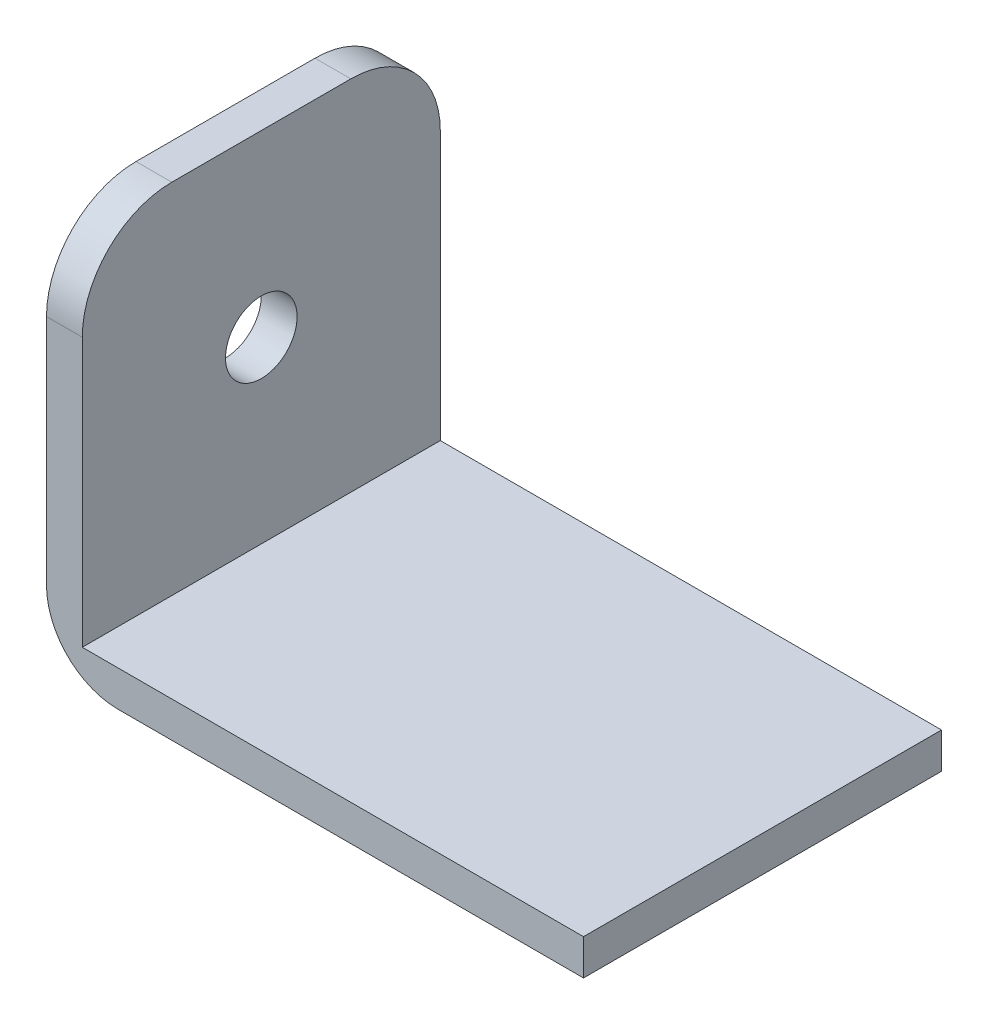
from build123d import *

# Parameters (mm, degrees)
SKETCH1_W           = 5
SKETCH1_H           = 50
SKETCH1_W_2         = 70
SKETCH1_H_2         = 5
BOSS_EXTRUDE1_DEPTH = 50
SKETCH2_R           = 5
CUT_EXTRUDE1_DEPTH  = 5
FILLET1_R           = 10
FILLET2_R           = 12.5


with BuildPart() as part:
    # Sketch1 → Boss-Extrude1 (new body)
    with BuildSketch(Plane.XY):
        with Locations((2.5, -25)):
            Rectangle(SKETCH1_W, SKETCH1_H)
        with Locations((40, -52.5)):
            Rectangle(SKETCH1_W_2, SKETCH1_H_2)
        with Locations((2.5, -52.5)):
            Rectangle(SKETCH1_W, SKETCH1_H_2)
    extrude(amount=BOSS_EXTRUDE1_DEPTH)

    # Sketch2 → Cut-Extrude1 (cut)
    with BuildSketch(Plane.ZY):
        with Locations(Location((25, -25, 0), (0, 0, 270))):
            Circle(SKETCH2_R)
    extrude(amount=-CUT_EXTRUDE1_DEPTH, mode=Mode.SUBTRACT)

    # Fillet1
    fillet1_edges = [part.edges().sort_by_distance(p)[0] for p in [
        (0, -55, 25),
    ]]
    fillet(fillet1_edges, radius=FILLET1_R)

    # Fillet2
    fillet2_edges = [part.edges().sort_by_distance(p)[0] for p in [
        (2.5, 0, 50),
        (2.5, 0, 0),
    ]]
    fillet(fillet2_edges, radius=FILLET2_R)


solid = part.part
